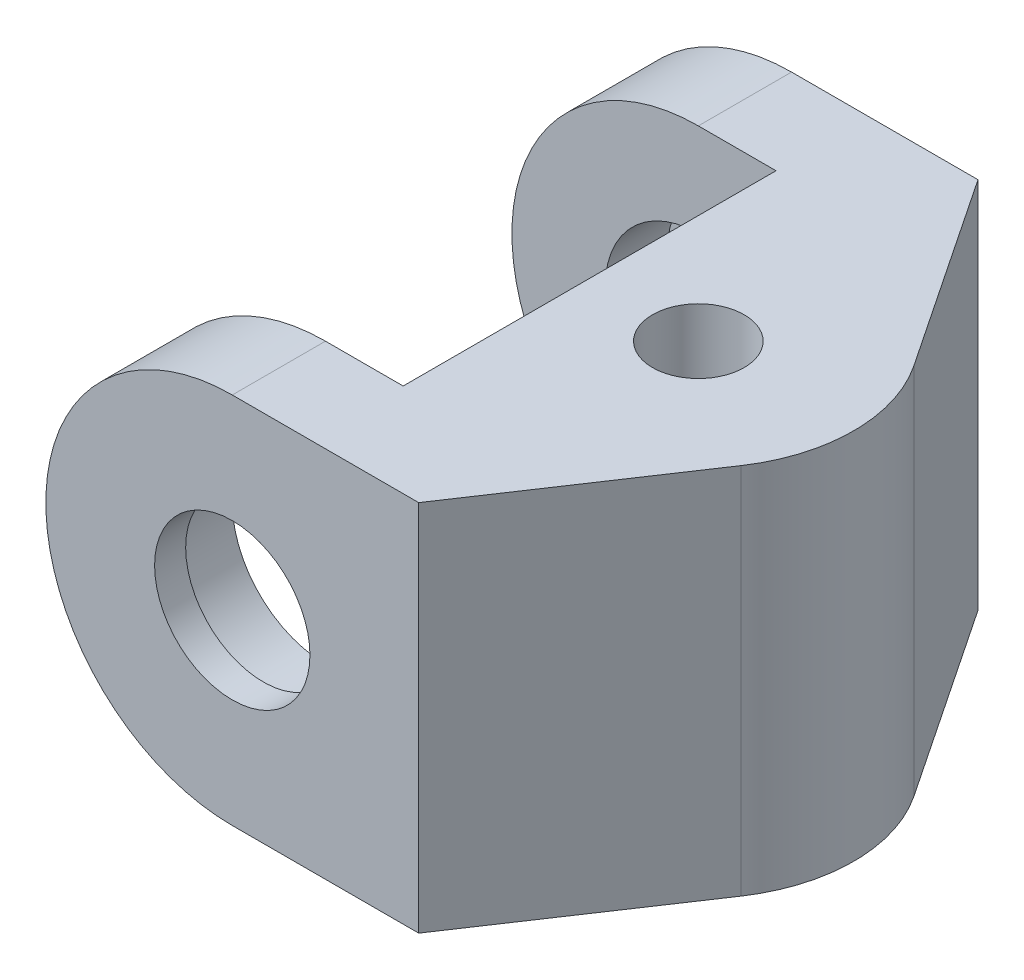
from build123d import *

# Parameters (mm, degrees)
SKETCH1_R               = 6
SKETCH1_R_2             = 2.5
BOSS_EXTRUDE1_DEPTH     = 9
SKETCH2_R               = 5
SKETCH2_R_2             = 1.475
BOSS_EXTRUDE2_DEPTH     = 6
BOSS_EXTRUDE3_DEPTH     = 6
CUT_EXTRUDE2_DEPTH      = 17.155494421
CUT_EXTRUDE2_DEPTH_BACK = 17.155494421
SKETCH5_R               = 1.475
SKETCH5_W               = 8.5
SKETCH5_H               = 12


with BuildPart() as part:
    # Sketch1 → Boss-Extrude1 (new, symmetric)
    with BuildSketch(Plane.XY):
        with Locations((-6, 0)):
            Circle(SKETCH1_R)
        with Locations((-6, 0)):
            Circle(SKETCH1_R_2, mode=Mode.SUBTRACT)
    extrude(amount=BOSS_EXTRUDE1_DEPTH, both=True)

    # Sketch2 → Boss-Extrude2 (add, symmetric)
    with BuildSketch(Plane(origin=(0, 0, 0), x_dir=(1, 0, 0), z_dir=(0, 1, 0))):
        Circle(SKETCH2_R)
        Circle(SKETCH2_R_2, mode=Mode.SUBTRACT)
    extrude(amount=BOSS_EXTRUDE2_DEPTH, both=True)

    # Sketch4 → Boss-Extrude3 (add, symmetric)
    with BuildSketch(Plane(origin=(0, 0, 0), x_dir=(1, 0, 0), z_dir=(0, 1, 0))):
        with BuildLine():
            Line((-6, 9), (-6, -9))
            Line((-6, -9), (0, -9))
            Line((0, -9), (4.157397096, -2.777777778))
            ThreePointArc((4.157397096, -2.777777778), (5, 0), (4.157397096, 2.777777778))
            Line((4.157397096, 2.777777778), (0, 9))
            Line((0, 9), (-6, 9))
        make_face()
    extrude(amount=BOSS_EXTRUDE3_DEPTH, both=True)

    # Sketch3 → Cut-Revolve1 (revolve, cut)
    with BuildSketch(Plane(origin=(0, 0, 0), x_dir=(1, 0, 0), z_dir=(0, 1, 0))):
        Polygon((-3.5, 8), (-3.5, 9), (-6, 9), (-6, -9), (-3.5, -9), (-3.5, -8), (-3, -8), (-3, -6), (-1.5, -6), (-1.5, 6), (-3, 6), (-3, 8), align=None)
    revolve(axis=Axis((-6, 0, -12.234149704), (0, 0, 1)), mode=Mode.SUBTRACT)

    # Sketch5 → Cut-Extrude2 (cut, two sides: drawn at the far end of the back side and taken through both)
    with BuildSketch(Plane(origin=(0, 0, 0), x_dir=(1, 0, 0), z_dir=(0, 1, 0)).offset(-CUT_EXTRUDE2_DEPTH_BACK)):
        Circle(SKETCH5_R)
        with Locations((-7.75, 0)):
            Rectangle(SKETCH5_W, SKETCH5_H)
    extrude(amount=CUT_EXTRUDE2_DEPTH + CUT_EXTRUDE2_DEPTH_BACK, mode=Mode.SUBTRACT)


solid = part.part
